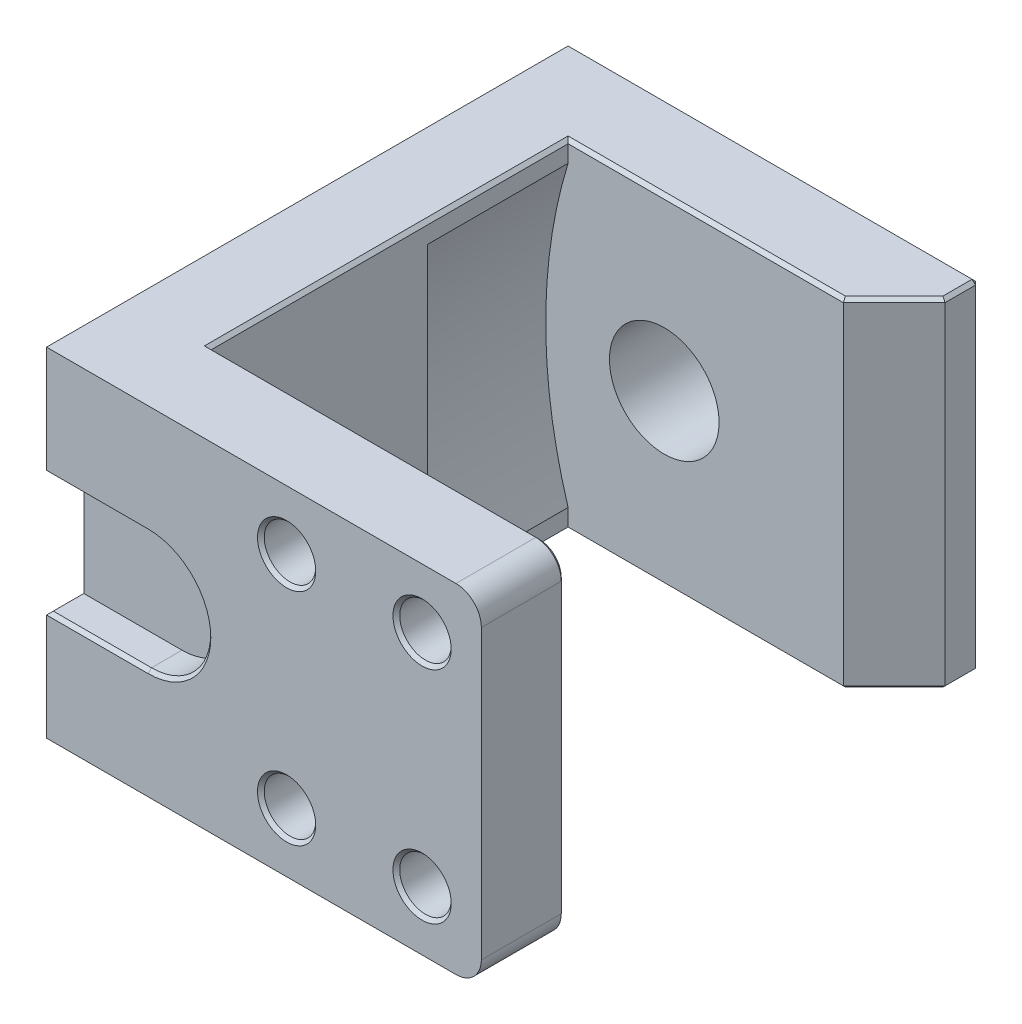
from build123d import *

# Parameters (mm, degrees)
SKETCH_1_R          = 3.2375
EXTRUDE_1_DEPTH     = 5
SKETCH_2_R          = 1.265
CUT_EXTRUDE_1_DEPTH = 2.85
CHAMFER_1_SIZE      = 0.2
SKETCH_5_W          = 1.72
SKETCH_5_H          = 14.55
EXTRUDE_2_DEPTH     = 1.55
CHAMFER_2_SIZE      = 0.2
FILLET_1_R          = 0.15
SKETCH_6_W          = 4.8
SKETCH_6_H          = 20
EXTRUDE_3_DEPTH     = 31
EXTRUDE_START       = 31
SKETCH_7_W          = 25.9
SKETCH_7_H          = 20
EXTRUDE_4_DEPTH     = 4.92
CUT_EXTRUDE_START   = 26.08
SKETCH_8_R          = 1.52
CUT_EXTRUDE_2_DEPTH = 4.92
CHAMFER_3_SIZE      = 0.2
CUT_EXTRUDE_START_2 = 31
SKETCH_10_W         = 4.38
SKETCH_10_H         = 20
CUT_EXTRUDE_3_DEPTH = 31
FILLET_2_R          = 1.5
CUT_EXTRUDE_4_DEPTH = 2
SKETCH_13_W         = 3.2
SKETCH_13_H         = 20
EXTRUDE_5_DEPTH     = 5
CHAMFER_5_SIZE      = 3
CUT_EXTRUDE_START_3 = 5
CUT_EXTRUDE_5_DEPTH = 7
CHAMFER_7_SIZE      = 1.3
CHAMFER_8_SIZE      = 0.2


with BuildPart() as part:
    # 草图1 → 凸台-拉伸1 (new body)
    with BuildSketch(Plane.XY):
        Polygon((13.5775, 0), (13.5775, 10), (-10.48, 10), (-10.48, 0), (-10.48, -10), (13.5775, -10), align=None)
        Circle(SKETCH_1_R, mode=Mode.SUBTRACT)
    extrude(amount=EXTRUDE_1_DEPTH)

    # 草图2 → 切除-拉伸1 (cut)
    with BuildSketch(Plane.XY):
        with Locations((0, 5.6)):
            Circle(SKETCH_2_R)
        with Locations((0, -5.6)):
            Circle(SKETCH_2_R)
    extrude(amount=CUT_EXTRUDE_1_DEPTH, mode=Mode.SUBTRACT)

    # 倒角1
    chamfer_1_edges = [part.edges().sort_by_distance(p)[0] for p in [
        (-1.265, 5.6, 0),
        (-1.265, -5.6, 0),
    ]]
    chamfer(chamfer_1_edges, length=CHAMFER_1_SIZE)

    # 草图5 → 凸台-拉伸2 (add)
    with BuildSketch(Plane.XY):
        with Locations((-9.62, 0)):
            Rectangle(SKETCH_5_W, SKETCH_5_H)
    extrude(amount=-EXTRUDE_2_DEPTH)

    # 倒角2
    chamfer_2_edges = [part.edges().sort_by_distance(p)[0] for p in [
        (-10.48, 0, -1.55),
        (-9.62, 7.275, -1.55),
        (-8.76, 0, -1.55),
        (-9.62, -7.275, -1.55),
    ]]
    chamfer(chamfer_2_edges, length=CHAMFER_2_SIZE)

    # 圆角1
    fillet_1_edges = [part.edges().sort_by_distance(p)[0] for p in [
        (-8.76, -7.275, -0.675),
        (-8.76, 7.275, -0.675),
        (-10.48, -7.275, -0.675),
        (-10.48, 7.275, -0.675),
    ]]
    fillet(fillet_1_edges, radius=FILLET_1_R)

    # 草图6 → 凸台-拉伸3 (add)
    with BuildSketch(Plane.XY):
        with Locations((-8.08, 0)):
            Rectangle(SKETCH_6_W, SKETCH_6_H)
    extrude(amount=EXTRUDE_3_DEPTH)

    # 草图7 → 凸台-拉伸4 (add)
    with BuildSketch(Plane.XY.offset(EXTRUDE_START)):
        with Locations((6.6275, 0)):
            Rectangle(SKETCH_7_W, SKETCH_7_H)
    extrude(amount=-EXTRUDE_4_DEPTH)

    # 草图8 → 切除-拉伸2 (cut)
    with BuildSketch(Plane.XY.offset(CUT_EXTRUDE_START)):
        with Locations((3.6975, 6.5)):
            Circle(SKETCH_8_R)
        with Locations((11.6975, 6.5)):
            Circle(SKETCH_8_R)
        with Locations((11.6975, -6.5)):
            Circle(SKETCH_8_R)
        with Locations((3.6975, -6.5)):
            Circle(SKETCH_8_R)
    extrude(amount=CUT_EXTRUDE_2_DEPTH, mode=Mode.SUBTRACT)

    # 倒角3
    chamfer_3_edges = [part.edges().sort_by_distance(p)[0] for p in [
        (2.1775, -6.5, 31),
        (10.1775, -6.5, 31),
        (10.1775, 6.5, 31),
        (2.1775, 6.5, 31),
    ]]
    chamfer(chamfer_3_edges, length=CHAMFER_3_SIZE)

    # 草图10 → 切除-拉伸3 (cut)
    with BuildSketch(Plane.XY.offset(CUT_EXTRUDE_START_2)):
        with Locations((17.3875, 0)):
            Rectangle(SKETCH_10_W, SKETCH_10_H)
    extrude(amount=-CUT_EXTRUDE_3_DEPTH, mode=Mode.SUBTRACT)

    # 圆角2
    fillet_2_edges = [part.edges().sort_by_distance(p)[0] for p in [
        (15.1975, -10, 28.54),
        (15.1975, 10, 28.54),
    ]]
    fillet(fillet_2_edges, radius=FILLET_2_R)

    # 草图11 → 切除-拉伸4 (cut)
    with BuildSketch(Plane.XY.offset(CUT_EXTRUDE_START_2)):
        with BuildLine():
            Line((-4.48, 3.5), (-10.48, 3.5))
            Line((-10.48, 3.5), (-10.48, -3.5))
            Line((-10.48, -3.5), (-4.48, -3.5))
            ThreePointArc((-4.48, -3.5), (-0.98, 0), (-4.48, 3.5))
        make_face()
    extrude(amount=-CUT_EXTRUDE_4_DEPTH, mode=Mode.SUBTRACT)

    # 草图13 → 凸台-拉伸5 (add)
    with BuildSketch(Plane.XY):
        with Locations((10.798987738, 0)):
            Rectangle(SKETCH_13_W, SKETCH_13_H)
    extrude(amount=EXTRUDE_5_DEPTH)

    # 倒角5
    chamfer_5_edges = [part.edges().sort_by_distance(p)[0] for p in [
        (13.5775, 0, 5),
    ]]
    chamfer(chamfer_5_edges, length=CHAMFER_5_SIZE)

    # 草图14 → 切除-拉伸5 (cut)
    with BuildSketch(Plane.XY.offset(CUT_EXTRUDE_START_3)):
        with BuildLine():
            Line((-5.284271247, 10), (-5.284271247, -10))
            ThreePointArc((-5.284271247, -10), (-7, 0), (-5.284271247, 10))
        make_face()
    extrude(amount=CUT_EXTRUDE_5_DEPTH, mode=Mode.SUBTRACT)

    # 倒角7
    chamfer_7_edges = [part.edges().sort_by_distance(p)[0] for p in [
        (-5.68, 0, 12),
    ]]
    chamfer(chamfer_7_edges, length=CHAMFER_7_SIZE)

    # 倒角8
    chamfer_8_edges = [part.edges().sort_by_distance(p)[0] for p in [
        (2.44875, -10, 5),
        (-5.68, -10, 15.54),
        (-5.68, 10, 15.54),
        (4.00875, 10, 26.08),
        (4.00875, -10, 26.08),
        (15.1975, 0, 26.08),
        (14.758160172, 9.560660172, 26.08),
        (14.758160172, -9.560660172, 26.08),
        (-7.48, 3.5, 31),
        (-10.48, 3.5, 30),
        (-7.48, -3.5, 31),
        (-10.48, -3.5, 30),
        (-10.48, 0, 29),
        (-0.98, 0, 31),
        (2.44875, 10, 5),
        (13.5775, 10, 1),
        (12.0775, 10, 3.5),
        (13.5775, -10, 1),
        (12.0775, -10, 3.5),
        (1.54875, -10, 0),
        (1.54875, 10, 0),
        (13.5775, 0, 0),
    ]]
    chamfer(chamfer_8_edges, length=CHAMFER_8_SIZE)


solid = part.part
